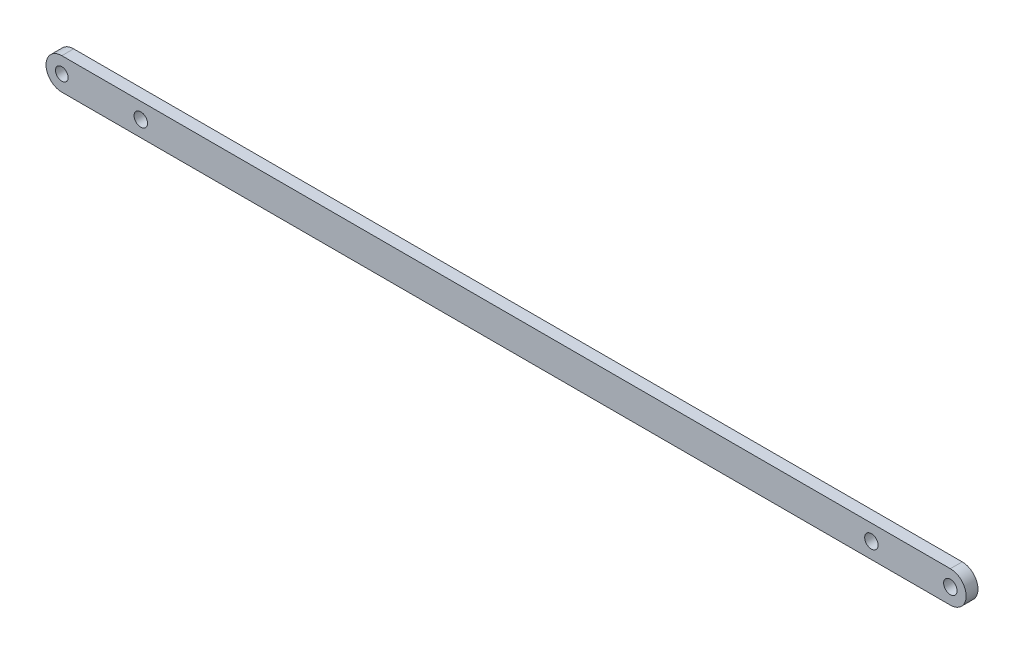
from build123d import *

# Parameters (mm, degrees)
SKETCH_1_R      = 1.6
SKETCH_1_R_2    = 1.7
EXTRUDE_1_DEPTH = 3


with BuildPart() as part:
    # 草图1 → 凸台-拉伸1 (new body)
    with BuildSketch(Plane.XY):
        with BuildLine():
            Line((-53.850242828, 4), (171.149757172, 4))
            ThreePointArc((171.149757172, 4), (175.149757172, 0), (171.149757172, -4))
            Line((171.149757172, -4), (-53.850242828, -4))
            ThreePointArc((-53.850242828, -4), (-57.850242828, 0), (-53.850242828, 4))
        make_face()
        with Locations((-53.850242828, 0)):
            Circle(SKETCH_1_R, mode=Mode.SUBTRACT)
        with Locations((171.149757172, 0)):
            Circle(SKETCH_1_R_2, mode=Mode.SUBTRACT)
        with Locations((151.149757172, 0)):
            Circle(SKETCH_1_R_2, mode=Mode.SUBTRACT)
        with Locations((-33.850242828, 0)):
            Circle(SKETCH_1_R_2, mode=Mode.SUBTRACT)
    extrude(amount=EXTRUDE_1_DEPTH)


solid = part.part
